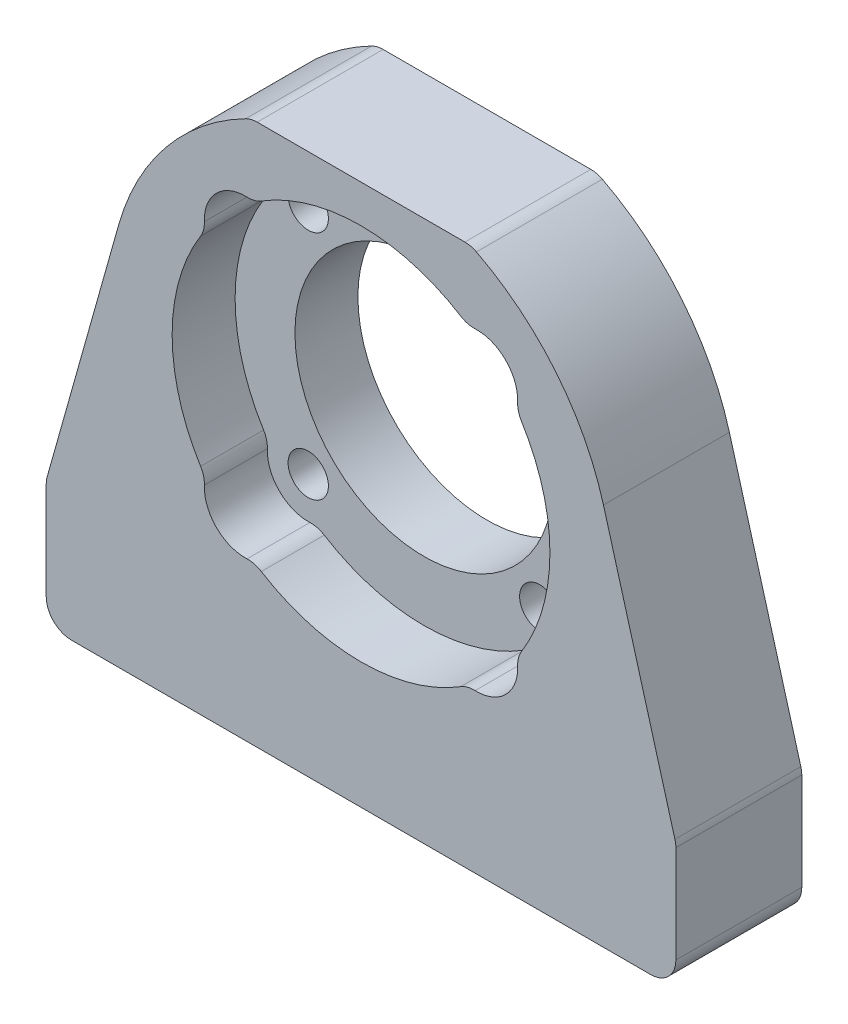
from build123d import *

# Parameters (mm, degrees)
SKETCH_1_R          = 10.25
SKETCH_1_R_2        = 1.6
EXTRUDE_1_DEPTH     = 10
SKETCH_3_R          = 1.65
CUT_EXTRUDE_2_DEPTH = 10
FILLET_1_R          = 2
CUT_EXTRUDE_START   = -5
SKETCH_4_R          = 1.6
CUT_EXTRUDE_3_DEPTH = 5
FILLET_2_R          = 2


with BuildPart() as part:
    # ｽｹｯﾁ1 → ﾎﾞｽ - 押し出し1 (new body)
    with BuildSketch(Plane.XY):
        with BuildLine():
            Line((-25, -15), (-19.25171886, 5.419531433))
            ThreePointArc((-19.25171886, 5.419531433), (-15.334292097, 12.83976191), (-8.717797887, 18))
            Line((-8.717797887, 18), (8.717797887, 18))
            ThreePointArc((8.717797887, 18), (15.334292097, 12.83976191), (19.25171886, 5.419531433))
            Line((19.25171886, 5.419531433), (25, -15))
            Line((25, -15), (25, -25))
            Line((25, -25), (-25, -25))
            Line((-25, -25), (-25, -15))
        make_face()
        Circle(SKETCH_1_R, mode=Mode.SUBTRACT)
        with Locations((9.192388155, 9.192388155)):
            Circle(SKETCH_1_R_2, mode=Mode.SUBTRACT)
        with Locations((9.192388155, -9.192388155)):
            Circle(SKETCH_1_R_2, mode=Mode.SUBTRACT)
        with Locations((-9.192388155, -9.192388155)):
            Circle(SKETCH_1_R_2, mode=Mode.SUBTRACT)
        with Locations((-9.192388155, 9.192388155)):
            Circle(SKETCH_1_R_2, mode=Mode.SUBTRACT)
    extrude(amount=EXTRUDE_1_DEPTH)

    # ｽｹｯﾁ3 → ｶｯﾄ - 押し出し2 (cut)
    with BuildSketch(Plane.XZ.offset(25)):
        with Locations(Location((-20, 5, 0), (0, 0, 270))):
            Circle(SKETCH_3_R)
        with Locations(Location((20, 5, 0), (0, 0, 90))):
            Circle(SKETCH_3_R)
    extrude(amount=-CUT_EXTRUDE_2_DEPTH, mode=Mode.SUBTRACT)

    # ﾌｨﾚｯﾄ1
    fillet_1_edges = [part.edges().sort_by_distance(p)[0] for p in [
        (25, -25, 5),
        (-25, -25, 5),
        (-25, -15, 5),
        (-8.717797887, 18, 5),
        (8.717797887, 18, 5),
        (25, -15, 5),
    ]]
    fillet(fillet_1_edges, radius=FILLET_1_R)

    # ｽｹｯﾁ4 → ｶｯﾄ - 押し出し3 (cut)
    with BuildSketch(Plane.XY.offset(10).offset(CUT_EXTRUDE_START)):
        with BuildLine():
            ThreePointArc((12.365702043, 8.49054845), (11.490485194, 11.490485194), (8.49054845, 12.365702043))
            ThreePointArc((8.49054845, 12.365702043), (0, 15), (-8.49054845, 12.365702043))
            ThreePointArc((-8.49054845, 12.365702043), (-11.490485194, 11.490485194), (-12.365702043, 8.49054845))
            ThreePointArc((-12.365702043, 8.49054845), (-15, 0), (-12.365702043, -8.49054845))
            ThreePointArc((-12.365702043, -8.49054845), (-11.490485194, -11.490485194), (-8.49054845, -12.365702043))
            ThreePointArc((-8.49054845, -12.365702043), (0, -15), (8.49054845, -12.365702043))
            ThreePointArc((8.49054845, -12.365702043), (11.490485194, -11.490485194), (12.365702043, -8.49054845))
            ThreePointArc((12.365702043, -8.49054845), (15, 0), (12.365702043, 8.49054845))
        make_face()
        with Locations((9.192388155, 9.192388155)):
            Circle(SKETCH_4_R, mode=Mode.SUBTRACT)
    extrude(amount=CUT_EXTRUDE_3_DEPTH, mode=Mode.SUBTRACT)

    # ﾌｨﾚｯﾄ2
    fillet_2_edges = [part.edges().sort_by_distance(p)[0] for p in [
        (-8.49054845, 12.365702043, 7.5),
        (8.49054845, 12.365702043, 7.5),
        (12.365702043, 8.49054845, 7.5),
        (12.365702043, -8.49054845, 7.5),
        (8.49054845, -12.365702043, 7.5),
        (-8.49054845, -12.365702043, 7.5),
        (-12.365702043, -8.49054845, 7.5),
        (-12.365702043, 8.49054845, 7.5),
    ]]
    fillet(fillet_2_edges, radius=FILLET_2_R)


solid = part.part
